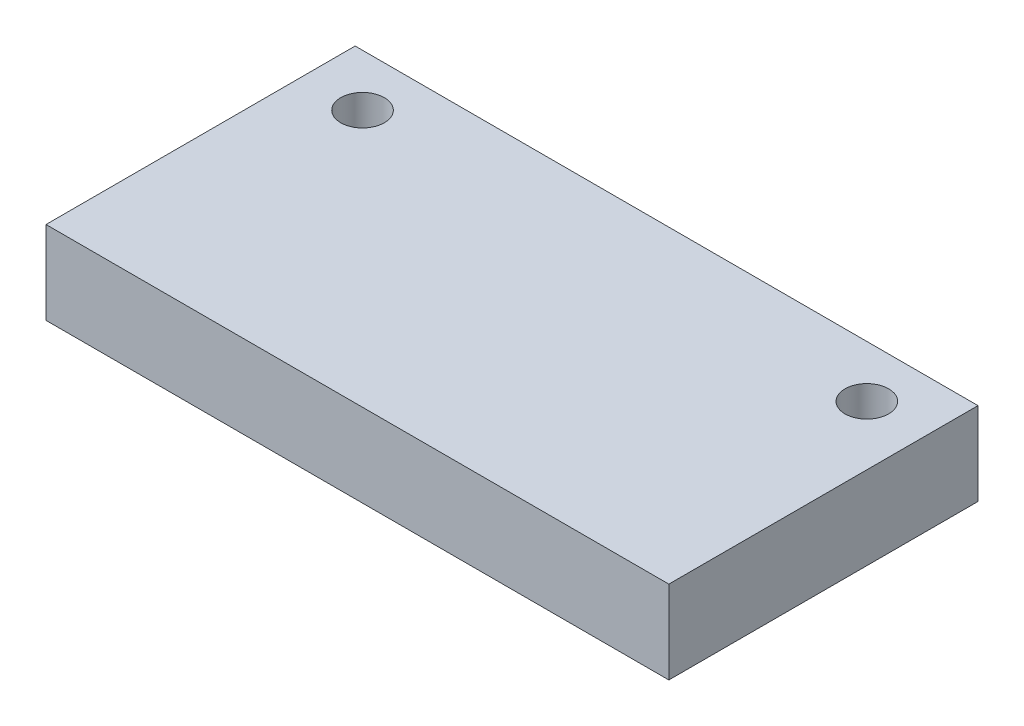
from build123d import *

# Parameters (mm, degrees)
SKETCH1_W           = 30
SKETCH1_H           = 5
SKETCH1_R           = 1.05
SKETCH1_H_2         = 9.890975922
BOSS_EXTRUDE1_DEPTH = 4


with BuildPart() as part:
    # Sketch1 → Boss-Extrude1 (new body)
    # profile 1 of 2: a face of its own
    with BuildSketch(Plane(origin=(0, 0, 0), x_dir=(1, 0, 0), z_dir=(0, 1, 0))):
        Rectangle(SKETCH1_W, SKETCH1_H)
        with Locations(Location((12.1449485, 0, 0), (0, 0, 270))):
            Circle(SKETCH1_R, mode=Mode.SUBTRACT)
        with Locations(Location((-12.1449485, 0, 0), (0, 0, 270))):
            Circle(SKETCH1_R, mode=Mode.SUBTRACT)
    # profile 2 of 2: a face of its own
    with BuildSketch(Plane(origin=(0, 0, 0), x_dir=(1, 0, 0), z_dir=(0, 1, 0))):
        with Locations((0, -7.445487961)):
            Rectangle(SKETCH1_W, SKETCH1_H_2)
    extrude(amount=BOSS_EXTRUDE1_DEPTH)


solid = part.part
